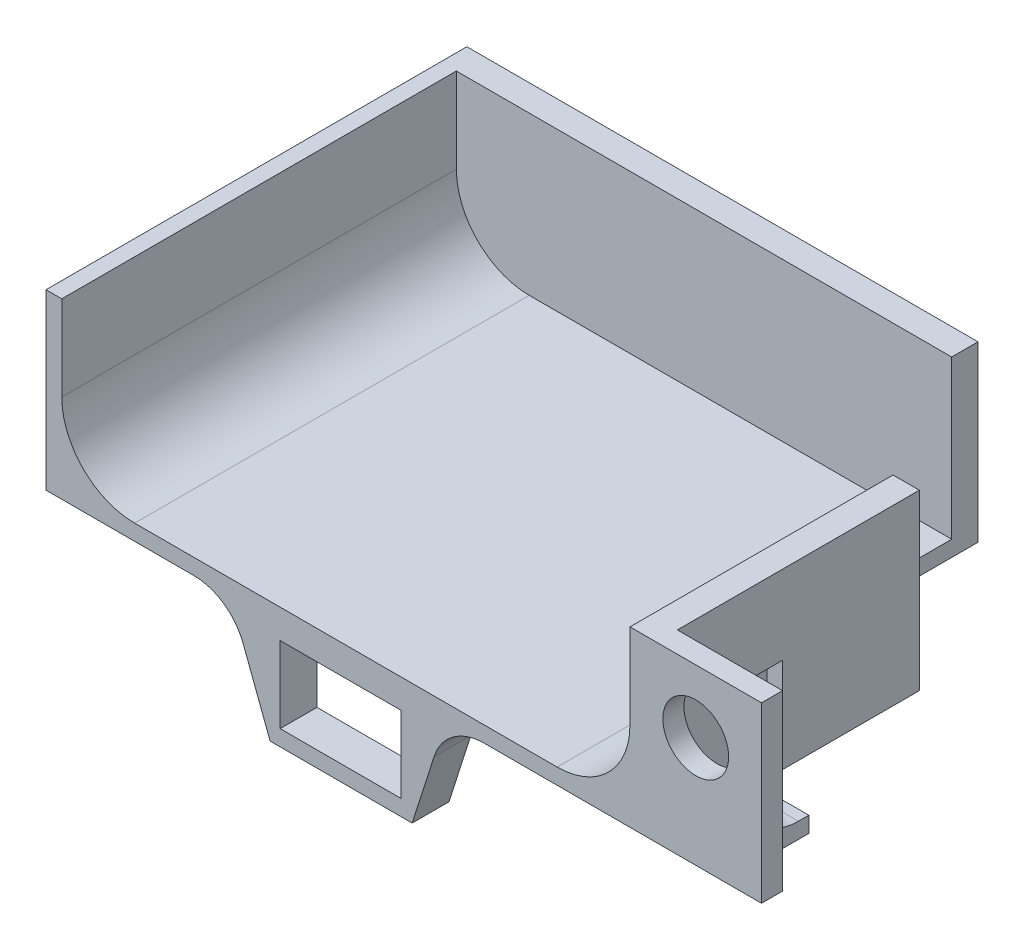
from build123d import *

# Parameters (mm, degrees)
ESQUISSE1_W             = 138
ESQUISSE1_H             = 75
BOSS_EXTRU_1_DEPTH      = 3
ESQUISSE2_W             = 5
ESQUISSE2_H             = 75
ESQUISSE2_W_2           = 25
BOSS_EXTRU_2_DEPTH      = 30
CONG_1_R                = 13.85
ESQUISSE3_W             = 138
ESQUISSE3_H             = 33
BOSS_EXTRU_3_DEPTH      = 5
ESQUISSE5_W             = 20
ESQUISSE5_H             = 76
ENL_V_MAT_EXTRU_2_DEPTH = 30
ESQUISSE6_R             = 6.25
ENL_V_MAT_EXTRU_3_DEPTH = 4
ESQUISSE7_W             = 20
ESQUISSE7_H             = 3
ENL_V_MAT_EXTRU_4_DEPTH = 30
ENL_V_MAT_EXTRU_5_REACH = 164.89
ESQUISSE8_W             = 18.85
ESQUISSE8_H             = 30
ESQUISSE10_W            = 8
ESQUISSE10_H            = 15
ENL_V_MAT_EXTRU_6_DEPTH = 3
ENL_V_MAT_EXTRU_7_DEPTH = 3
ESQUISSE12_W            = 80
ESQUISSE12_H            = 33
ENL_V_MAT_EXTRU_8_DEPTH = 2
BOSS_EXTRU_4_DEPTH      = 7
ESQUISSE14_W            = 23
ESQUISSE14_H            = 14.5
ENL_V_MAT_EXTRU_9_DEPTH = 7
CONG_2_R                = 10


with BuildPart() as part:
    # Esquisse1 → Boss.-Extru.1 (new body)
    with BuildSketch(Plane(origin=(0, 0, 0), x_dir=(1, 0, 0), z_dir=(0, 1, 0))):
        with Locations((69, 37.5)):
            Rectangle(ESQUISSE1_W, ESQUISSE1_H)
    extrude(amount=BOSS_EXTRU_1_DEPTH)

    # Esquisse2 → Boss.-Extru.2 (add)
    with BuildSketch(Plane(origin=(0, 3, 0), x_dir=(1, 0, 0), z_dir=(0, 1, 0))):
        with Locations((2.5, 37.5)):
            Rectangle(ESQUISSE2_W, ESQUISSE2_H)
        with Locations((125.5, 37.5)):
            Rectangle(ESQUISSE2_W_2, ESQUISSE2_H)
    extrude(amount=BOSS_EXTRU_2_DEPTH)

    # Congé1
    cong_1_edges = [part.edges().sort_by_distance(p)[0] for p in [
        (5, 3, -37.5),
        (113, 3, -37.5),
    ]]
    fillet(cong_1_edges, radius=CONG_1_R)

    # Esquisse3 → Boss.-Extru.3 (add)
    with BuildSketch(Plane(origin=(0, 0, -75), x_dir=(-1, 0, 0), z_dir=(0, 0, -1))):
        with Locations((-69, 16.5)):
            Rectangle(ESQUISSE3_W, ESQUISSE3_H)
    extrude(amount=BOSS_EXTRU_3_DEPTH)

    # Esquisse5 → Enlèv. mat.-Extru.2 (cut)
    with BuildSketch(Plane(origin=(0, 33, 0), x_dir=(1, 0, 0), z_dir=(0, 1, 0))):
        with Locations((128, 42)):
            Rectangle(ESQUISSE5_W, ESQUISSE5_H)
    extrude(amount=-ENL_V_MAT_EXTRU_2_DEPTH, mode=Mode.SUBTRACT)

    # Esquisse6 → Enlèv. mat.-Extru.3 (cut)
    with BuildSketch(Plane.XY):
        with Locations((125.5, 21)):
            Circle(ESQUISSE6_R)
    extrude(amount=-ENL_V_MAT_EXTRU_3_DEPTH, mode=Mode.SUBTRACT)

    # Esquisse7 → Enlèv. mat.-Extru.4 (cut)
    with BuildSketch(Plane(origin=(0, 0, -80), x_dir=(-1, 0, 0), z_dir=(0, 0, -1))):
        with Locations((-128, 1.5)):
            Rectangle(ESQUISSE7_W, ESQUISSE7_H)
    extrude(amount=-ENL_V_MAT_EXTRU_4_DEPTH, mode=Mode.SUBTRACT)

    # Enlèv. mat.-Extru.5: up to this face of the body (flat: up to its plane)
    enl_v_mat_extru_5_end = Plane(part.part.faces().sort_by_distance((65.609195402, 0, -38.563218391))[0])
    # Esquisse8 → Enlèv. mat.-Extru.5 (cut, up to the picked face)
    with BuildSketch(Plane(origin=(0, 33, 0), x_dir=(1, 0, 0), z_dir=(0, 1, 0)), mode=Mode.PRIVATE) as enl_v_mat_extru_5_sk1:
        with Locations((108.575, 65)):
            Rectangle(ESQUISSE8_W, ESQUISSE8_H)
    enl_v_mat_extru_5_tool1 = split(extrude(enl_v_mat_extru_5_sk1.sketch, amount=-ENL_V_MAT_EXTRU_5_REACH, mode=Mode.PRIVATE), bisect_by=enl_v_mat_extru_5_end, keep=Keep.BOTH, mode=Mode.PRIVATE)
    add(enl_v_mat_extru_5_tool1.solids().sort_by(Axis((108.575, 33, -65), (0, -1, 0)))[0], mode=Mode.SUBTRACT)

    # Esquisse10 → Enlèv. mat.-Extru.6 (cut)
    with BuildSketch(Plane(origin=(118, 0, 0), x_dir=(0, 0, -1), z_dir=(1, 0, 0))):
        with Locations((20, 10.5)):
            Rectangle(ESQUISSE10_W, ESQUISSE10_H)
    extrude(amount=-ENL_V_MAT_EXTRU_6_DEPTH, mode=Mode.SUBTRACT)

    # Esquisse11 → Enlèv. mat.-Extru.7 (cut)
    with BuildSketch(Plane(origin=(0, 3, 0), x_dir=(1, 0, 0), z_dir=(0, 1, 0))):
        Polygon((115, 24), (118, 24), (118, 50), (138, 50), (138, 4), (131, 4), (131, 16), (115, 16), align=None)
    extrude(amount=-ENL_V_MAT_EXTRU_7_DEPTH, mode=Mode.SUBTRACT)

    # Esquisse12 → Enlèv. mat.-Extru.8 (cut)
    with BuildSketch(Plane.ZY):
        with Locations((-40, 16.5)):
            Rectangle(ESQUISSE12_W, ESQUISSE12_H)
    extrude(amount=-ENL_V_MAT_EXTRU_8_DEPTH, mode=Mode.SUBTRACT)

    # Esquisse13 → Boss.-Extru.4 (add)
    with BuildSketch(Plane.XY):
        Polygon((37, 0), (44.596875763, -20), (71.596875763, -20), (78, 0), align=None)
    extrude(amount=-BOSS_EXTRU_4_DEPTH)

    # Esquisse14 → Enlèv. mat.-Extru.9 (cut)
    with BuildSketch(Plane.XY):
        with Locations((58, -9.75)):
            Rectangle(ESQUISSE14_W, ESQUISSE14_H)
    extrude(amount=-ENL_V_MAT_EXTRU_9_DEPTH, mode=Mode.SUBTRACT)

    # Congé2
    cong_2_edges = [part.edges().sort_by_distance(p)[0] for p in [
        (37, 0, -3.5),
        (78, 0, -3.5),
        (124.5, 3, -4),
    ]]
    fillet(cong_2_edges, radius=CONG_2_R)


solid = part.part
